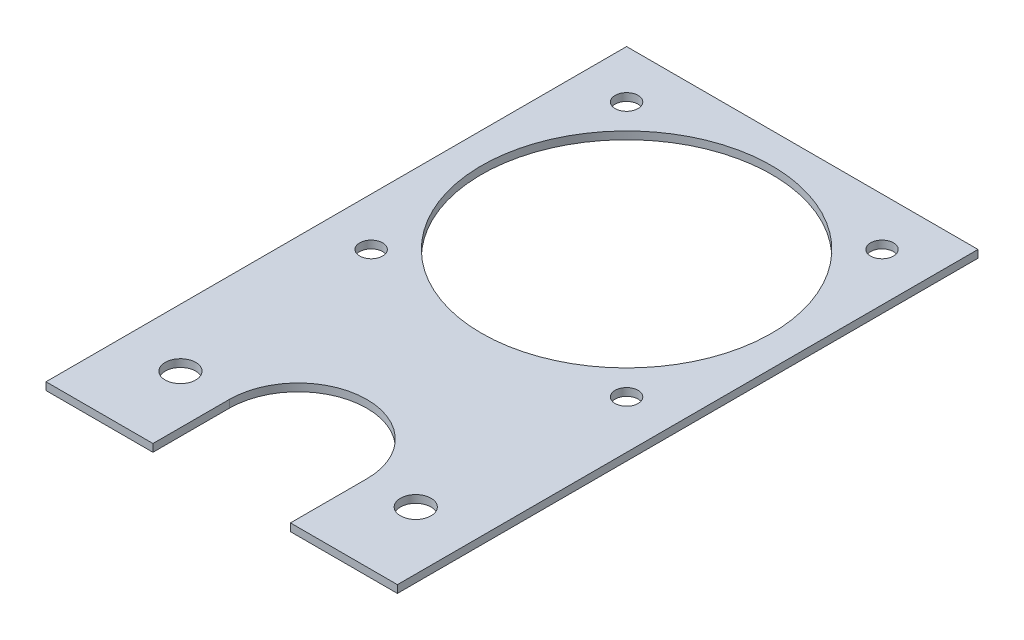
from build123d import *

# Parameters (mm, degrees)
SKETCH_1_R      = 2
SKETCH_1_W      = 40
SKETCH_1_H      = 40
SKETCH_1_R_2    = 1.5
SKETCH_1_R_3    = 19
EXTRUDE_1_DEPTH = 1


with BuildPart() as part:
    # Эскиз1 → Бобышка-Вытянуть1 (new body)
    # profile 1 of 2: a face of its own
    with BuildSketch(Plane(origin=(0, 0, 0), x_dir=(1, 0, 0), z_dir=(0, 1, 0))):
        with BuildLine():
            Line((-9, -28), (-9, -38))
            Line((-9, -38), (-23, -38))
            Line((-23, -38), (-23, 38))
            Line((-23, 38), (23, 38))
            Line((23, 38), (23, -38))
            Line((23, -38), (9, -38))
            Line((9, -38), (9, -28))
            ThreePointArc((9, -28), (0, -19), (-9, -28))
        make_face()
        with Locations(Location((15.4, -28, 0), (0, 0, 270))):
            Circle(SKETCH_1_R, mode=Mode.SUBTRACT)
        with Locations(Location((-15.4, -28, 0), (0, 0, 270))):
            Circle(SKETCH_1_R, mode=Mode.SUBTRACT)
        with Locations((0, 15)):
            Rectangle(SKETCH_1_W, SKETCH_1_H, mode=Mode.SUBTRACT)
    # profile 2 of 2: a face of its own
    with BuildSketch(Plane(origin=(0, 0, 0), x_dir=(1, 0, 0), z_dir=(0, 1, 0))):
        with Locations((0, 15)):
            Rectangle(SKETCH_1_W, SKETCH_1_H)
        with Locations(Location((-16.717514421, -1.717514421, 0), (0, 0, 270))):
            Circle(SKETCH_1_R_2, mode=Mode.SUBTRACT)
        with Locations(Location((16.717514421, -1.717514421, 0), (0, 0, 270))):
            Circle(SKETCH_1_R_2, mode=Mode.SUBTRACT)
        with Locations(Location((16.717514421, 31.717514421, 0), (0, 0, 270))):
            Circle(SKETCH_1_R_2, mode=Mode.SUBTRACT)
        with Locations(Location((-16.717514421, 31.717514421, 0), (0, 0, 270))):
            Circle(SKETCH_1_R_2, mode=Mode.SUBTRACT)
        with Locations(Location((0, 15, 0), (0, 0, 270))):
            Circle(SKETCH_1_R_3, mode=Mode.SUBTRACT)
    extrude(amount=EXTRUDE_1_DEPTH)


solid = part.part
